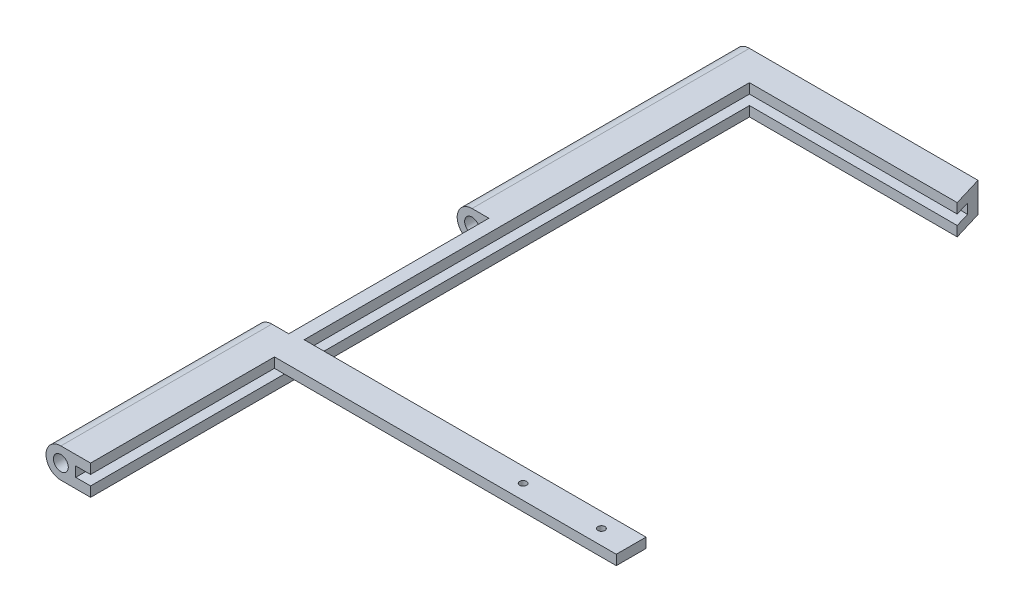
from build123d import *

# Parameters (mm, degrees)
EXTRUDE_1_DEPTH                   = 3
SKETCH_2_R                        = 1.5
SKETCH_2_R_2                      = 0.75
EXTRUDE_2_DEPTH                   = 73
SKETCH_3_W                        = 42
SKETCH_3_H                        = 3.5
SKETCH_3_W_2                      = 3.2
SKETCH_3_H_2                      = 20.2
CUT_EXTRUDE_1_DEPTH               = 83.725086884
CUT_EXTRUDE_2_REACH               = 84.028
CUT_EXTRUDE_2_OFFSET_FROM_SURFACE = 1.5
CUT_EXTRUDE_START                 = -1.5
SKETCH_4_W                        = 44.5
SKETCH_4_H                        = 1
SKETCH_4_3_W                      = 22
SKETCH_4_3_H                      = 1
CUT_EXTRUDE_3_DEPTH               = 37.5
SKETCH_5_W                        = 3
SKETCH_5_H                        = 1
EXTRUDE_3_DEPTH                   = 34.5
SKETCH_6_R                        = 0.35
CUT_EXTRUDE_4_DEPTH               = 80.653562381
SKETCH_7_W                        = 24.036657481
SKETCH_7_H                        = 1
CUT_EXTRUDE_5_DEPTH               = 1.5
CUT_EXTRUDE_6_DEPTH               = 80.653562381


with BuildPart() as part:
    # 草图1 → 凸台-拉伸1 (new body)
    with BuildSketch(Plane(origin=(0, 0, 0), x_dir=(1, 0, 0), z_dir=(0, 1, 0))):
        Polygon((0, 0), (0, -73), (38.8, -73), (38.8, -47.5), (24.5, 0), align=None)
    extrude(amount=EXTRUDE_1_DEPTH)

    # 草图2 → 凸台-拉伸2 (add)
    # profile 1 of 2: a face of its own
    with BuildSketch(Plane(origin=(0, 0, 0), x_dir=(-1, 0, 0), z_dir=(0, 0, -1))):
        with BuildLine():
            Line((0, 3), (0, 0))
            Line((0, 0), (1.7, 0))
            ThreePointArc((1.7, 0), (0.2, 1.5), (1.7, 3))
            Line((1.7, 3), (0, 3))
        make_face()
    # profile 2 of 2: a face of its own
    with BuildSketch(Plane(origin=(0, 0, 0), x_dir=(-1, 0, 0), z_dir=(0, 0, -1))):
        with Locations((1.7, 1.5)):
            Circle(SKETCH_2_R)
        with Locations((1.7, 1.5)):
            Circle(SKETCH_2_R_2, mode=Mode.SUBTRACT)
    extrude(amount=-EXTRUDE_2_DEPTH)

    # 草图3 → 切除-拉伸1 (cut, through all)
    with BuildSketch(Plane(origin=(0, 3, 0), x_dir=(1, 0, 0), z_dir=(0, 1, 0))):
        with Locations((17.8, -71.25)):
            Rectangle(SKETCH_3_W, SKETCH_3_H)
        with Locations((-1.6, -38.1)):
            Rectangle(SKETCH_3_W_2, SKETCH_3_H_2)
        Polygon((1.3, -3), (22.270157068, -3), (35.8, -47.941785964), (35.8, -69.5), (1.3, -69.5), align=None)
    extrude(amount=-CUT_EXTRUDE_1_DEPTH, mode=Mode.SUBTRACT)

    # 切除-拉伸2: up to this face of the body (flat: up to its plane, moved by the offset)
    cut_extrude_2_end = Plane(part.part.faces().sort_by_distance((29.035078534, 1.5, 25.470892982))[0]).offset(-CUT_EXTRUDE_2_OFFSET_FROM_SURFACE)
    # 草图4 → 切除-拉伸2 (cut, up to the picked face)
    with BuildSketch(Plane(origin=(1.3, 0, 0), x_dir=(0, 0, -1), z_dir=(1, 0, 0)).offset(CUT_EXTRUDE_START), mode=Mode.PRIVATE) as cut_extrude_2_sk1:
        with Locations((-25.25, 1.5)):
            Rectangle(SKETCH_4_W, SKETCH_4_H)
    cut_extrude_2_tool1 = split(extrude(cut_extrude_2_sk1.sketch, amount=CUT_EXTRUDE_2_REACH, mode=Mode.PRIVATE), bisect_by=cut_extrude_2_end, keep=Keep.BOTH, mode=Mode.PRIVATE)
    add(cut_extrude_2_tool1.solids().sort_by(Axis((-0.2, 1.5, 25.25), (1, 0, 0)))[0], mode=Mode.SUBTRACT)

    # 草图4<3> → 切除-拉伸3 (cut)
    with BuildSketch(Plane(origin=(1.3, 0, 0), x_dir=(0, 0, -1), z_dir=(1, 0, 0)).offset(CUT_EXTRUDE_START)):
        with Locations((-58.5, 1.5)):
            Rectangle(SKETCH_4_3_W, SKETCH_4_3_H)
    extrude(amount=CUT_EXTRUDE_3_DEPTH, mode=Mode.SUBTRACT)

    # 草图5 → 凸台-拉伸3 (add)
    with BuildSketch(Plane.ZY.offset(-35.8)):
        with Locations((49.441785964, 2.5)):
            Rectangle(SKETCH_5_W, SKETCH_5_H)
    extrude(amount=EXTRUDE_3_DEPTH)

    # 草图6 → 切除-拉伸4 (cut, through all)
    with BuildSketch(Plane(origin=(0, 3, 0), x_dir=(1, 0, 0), z_dir=(0, 1, 0))):
        with Locations(Location((32.8, -49.441785964, 0), (0, 0, 270))):
            Circle(SKETCH_6_R)
        with Locations(Location((24.9, -49.441785964, 0), (0, 0, 270))):
            Circle(SKETCH_6_R)
    extrude(amount=-CUT_EXTRUDE_4_DEPTH, mode=Mode.SUBTRACT)

    # 草图7 → 切除-拉伸5 (cut)
    with BuildSketch(Plane.XY.offset(3)):
        with Locations((11.818328741, 1.5)):
            Rectangle(SKETCH_7_W, SKETCH_7_H)
    extrude(amount=-CUT_EXTRUDE_5_DEPTH, mode=Mode.SUBTRACT)

    # 草图8 → 切除-拉伸6 (cut, through all)
    with BuildSketch(Plane(origin=(0, 3, 0), x_dir=(1, 0, 0), z_dir=(0, 1, 0))):
        Polygon((20.332372981, 3.436695391), (35.8, -47.941785964), (35.8, -72.849501568), (56.307983414, -72.849501568), (56.307983414, 3.436695391), align=None)
    extrude(amount=-CUT_EXTRUDE_6_DEPTH, mode=Mode.SUBTRACT)


solid = part.part
